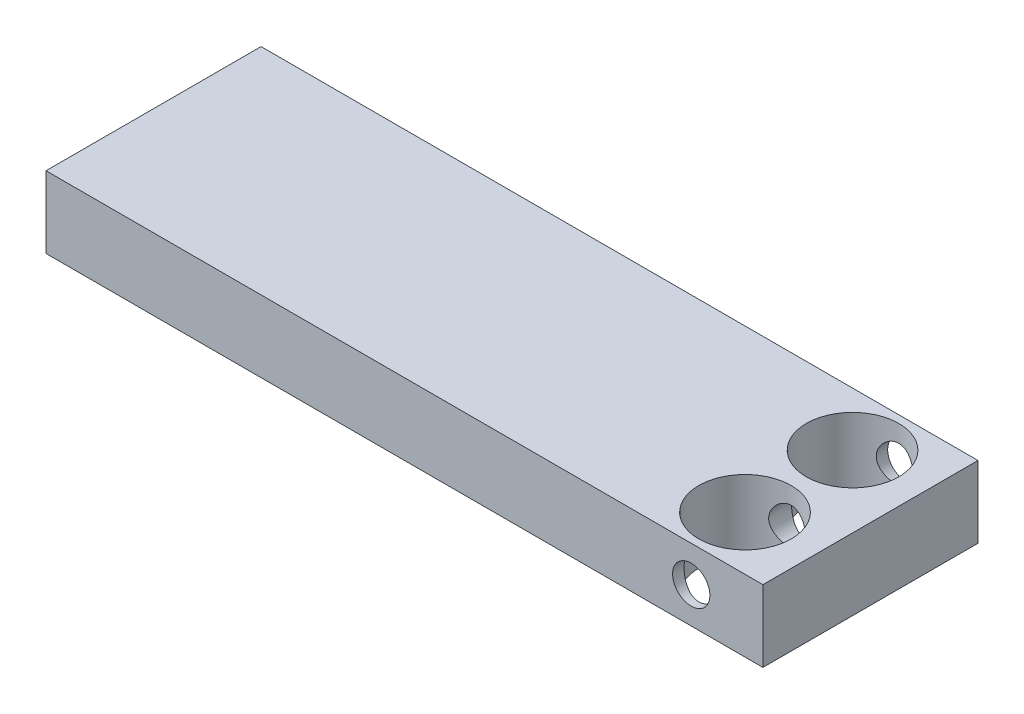
from build123d import *

# Parameters (mm, degrees)
SKETCH1_W           = 100
SKETCH1_H           = 30
SKETCH1_R           = 6.45
BOSS_EXTRUDE1_DEPTH = 10
SKETCH2_R           = 2.6
CUT_EXTRUDE1_DEPTH  = 82.56838771


with BuildPart() as part:
    # Sketch1 → Boss-Extrude1 (new body)
    with BuildSketch(Plane(origin=(0, 0, 0), x_dir=(1, 0, 0), z_dir=(0, 1, 0))):
        with Locations((25.189107413, 4.069591528)):
            Rectangle(SKETCH1_W, SKETCH1_H)
        with Locations(Location((65.189107413, 11.569591528, 0), (0, 0, 270))):
            Circle(SKETCH1_R, mode=Mode.SUBTRACT)
        with Locations(Location((65.189107413, -3.430408472, 0), (0, 0, 270))):
            Circle(SKETCH1_R, mode=Mode.SUBTRACT)
    extrude(amount=BOSS_EXTRUDE1_DEPTH)

    # Sketch2 → Cut-Extrude1 (cut, through all)
    with BuildSketch(Plane.XY.offset(10.930408472)):
        with Locations((65.189107413, 5)):
            Circle(SKETCH2_R)
    extrude(amount=-CUT_EXTRUDE1_DEPTH, mode=Mode.SUBTRACT)


solid = part.part
